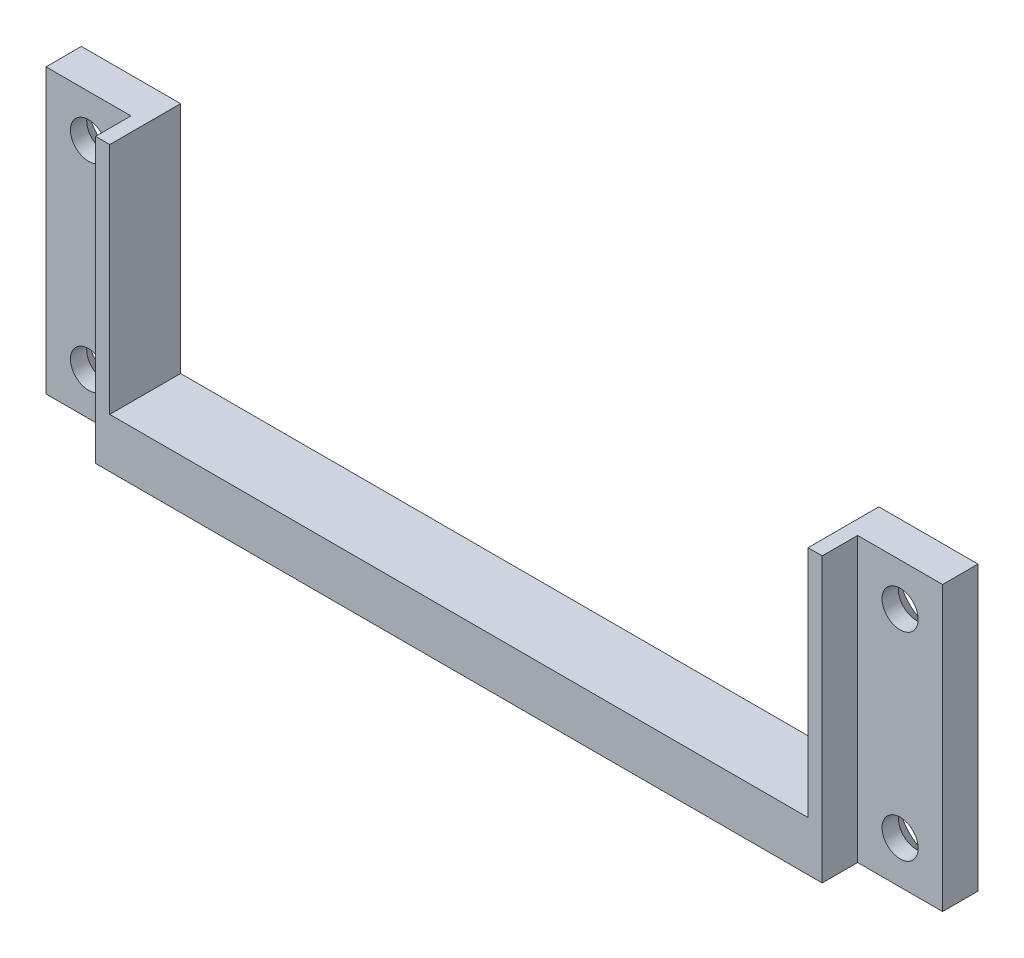
from build123d import *

# Parameters (mm, degrees)
BOSS_EXTRU_1_DEPTH                                = 10
BOSS_EXTRU_1_DEPTH_BACK                           = 0.0001
ESQUISSE1_W                                       = 102.6
ESQUISSE1_H                                       = 35
ESQUISSE4_W                                       = 98.6
ESQUISSE4_H                                       = 51.6
ENL_V_MAT_EXTRU_2_DEPTH                           = 33
ESQUISSE19_W                                      = 102.6
ESQUISSE19_H                                      = 10.0001
BOSS_EXTRU_4_DEPTH                                = 5
ESQUISSE21_W                                      = 5
ESQUISSE21_H                                      = 40
BOSS_EXTRU_5_DEPTH                                = 12
ESQUISSE22_W                                      = 5
ESQUISSE22_H                                      = 40
BOSS_EXTRU_6_DEPTH                                = 12
FRAISAGE_POUR_VIS_T_TE_FRAIS_E_BOMB_E_D           = 5.09999996
FRAISAGE_POUR_VIS_T_TE_FRAIS_E_BOMB_E_CSINK_D     = 10.500000082
FRAISAGE_POUR_VIS_T_TE_FRAIS_E_BOMB_E_CSINK_ANGLE = 90


with BuildPart() as part:
    # Esquisse1 → Boss.-Extru.1 (new, two sides: drawn at the far end of the back side and taken through both)
    with BuildSketch(Plane.XY.offset(-BOSS_EXTRU_1_DEPTH_BACK)):
        with Locations((33.832170394, 1.686746988)):
            Rectangle(ESQUISSE1_W, ESQUISSE1_H)
    extrude(amount=BOSS_EXTRU_1_DEPTH + BOSS_EXTRU_1_DEPTH_BACK)

    # Esquisse4 → Enlèv. mat.-Extru.2 (cut)
    with BuildSketch(Plane(origin=(0, 19.186746988, 0), x_dir=(1, 0, 0), z_dir=(0, 1, 0))):
        with Locations((33.832170394, -25.7999)):
            Rectangle(ESQUISSE4_W, ESQUISSE4_H)
    extrude(amount=-ENL_V_MAT_EXTRU_2_DEPTH, mode=Mode.SUBTRACT)

    # Esquisse19 → Boss.-Extru.4 (add)
    with BuildSketch(Plane.XZ.offset(15.813253012)):
        with Locations((33.832170394, 4.99995)):
            Rectangle(ESQUISSE19_W, ESQUISSE19_H)
    extrude(amount=BOSS_EXTRU_4_DEPTH)

    # Esquisse21 → Boss.-Extru.5 (add)
    with BuildSketch(Plane.ZY.offset(17.467829606)):
        with Locations((2.4999, -0.813253012)):
            Rectangle(ESQUISSE21_W, ESQUISSE21_H)
    extrude(amount=BOSS_EXTRU_5_DEPTH)

    # Esquisse22 → Boss.-Extru.6 (add)
    with BuildSketch(Plane(origin=(85.132170394, 0, 0), x_dir=(0, 0, -1), z_dir=(1, 0, 0))):
        with Locations((-2.4999, -0.813253012)):
            Rectangle(ESQUISSE22_W, ESQUISSE22_H)
    extrude(amount=BOSS_EXTRU_6_DEPTH)

    # Fraisage pour vis à tête fraisée bombée #51 (through all)
    with Locations(Plane(origin=(91.132170394, 13.186746988, -0.0001), x_dir=(-1, 0, 0), z_dir=(0, 0, -1))):
        with Locations((0, 0), (0, -28), (114.6, 0), (114.6, -28)):
            CounterSinkHole(FRAISAGE_POUR_VIS_T_TE_FRAIS_E_BOMB_E_D / 2, FRAISAGE_POUR_VIS_T_TE_FRAIS_E_BOMB_E_CSINK_D / 2, counter_sink_angle=FRAISAGE_POUR_VIS_T_TE_FRAIS_E_BOMB_E_CSINK_ANGLE)


solid = part.part
